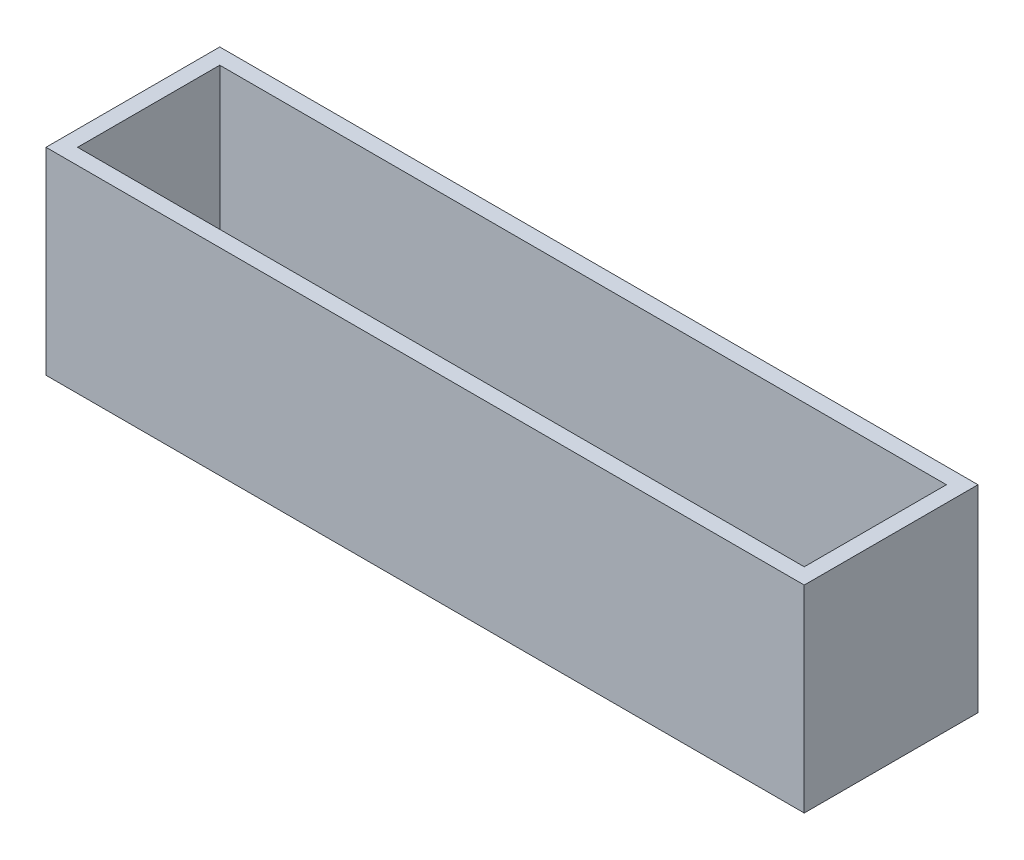
from build123d import *

# Parameters (mm, degrees)
SKETCH1_W           = 304.8
SKETCH1_H           = 69.85
BOSS_EXTRUDE1_DEPTH = 3.175
SKETCH2_W           = 304.8
SKETCH2_H           = 69.85
SKETCH2_W_2         = 292.1
SKETCH2_H_2         = 57.15
BOSS_EXTRUDE2_DEPTH = 76.2


with BuildPart() as part:
    # Sketch1 → Boss-Extrude1 (new body)
    with BuildSketch(Plane(origin=(0, 0, 0), x_dir=(1, 0, 0), z_dir=(0, 1, 0))):
        Rectangle(SKETCH1_W, SKETCH1_H)
    extrude(amount=BOSS_EXTRUDE1_DEPTH)

    # Sketch2 → Boss-Extrude2 (add)
    with BuildSketch(Plane(origin=(0, 3.175, 0), x_dir=(1, 0, 0), z_dir=(0, 1, 0))):
        Rectangle(SKETCH2_W, SKETCH2_H)
        Rectangle(SKETCH2_W_2, SKETCH2_H_2, mode=Mode.SUBTRACT)
    extrude(amount=BOSS_EXTRUDE2_DEPTH)


solid = part.part
